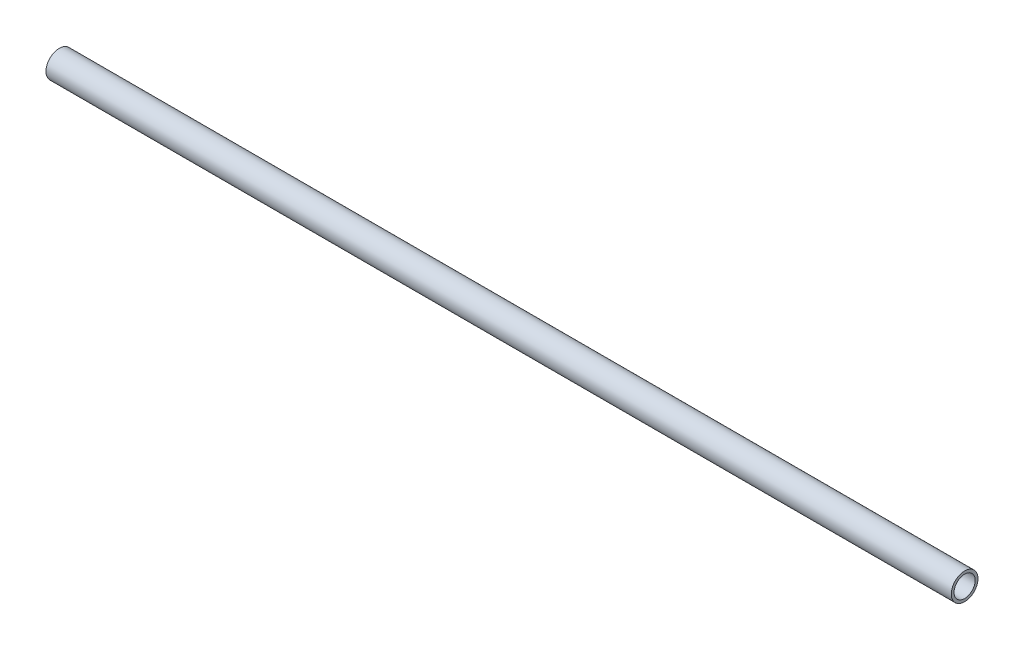
from build123d import *

# Parameters (mm, degrees)
SKETCH1_R           = 6.2
SKETCH1_R_2         = 4.898126267
BOSS_EXTRUDE1_DEPTH = 420


with BuildPart() as part:
    # Sketch1 → Boss-Extrude1 (new body)
    with BuildSketch(Plane(origin=(0, 0, 0), x_dir=(0, 0, -1), z_dir=(1, 0, 0))):
        Circle(SKETCH1_R)
        Circle(SKETCH1_R_2, mode=Mode.SUBTRACT)
    extrude(amount=BOSS_EXTRUDE1_DEPTH)


solid = part.part
